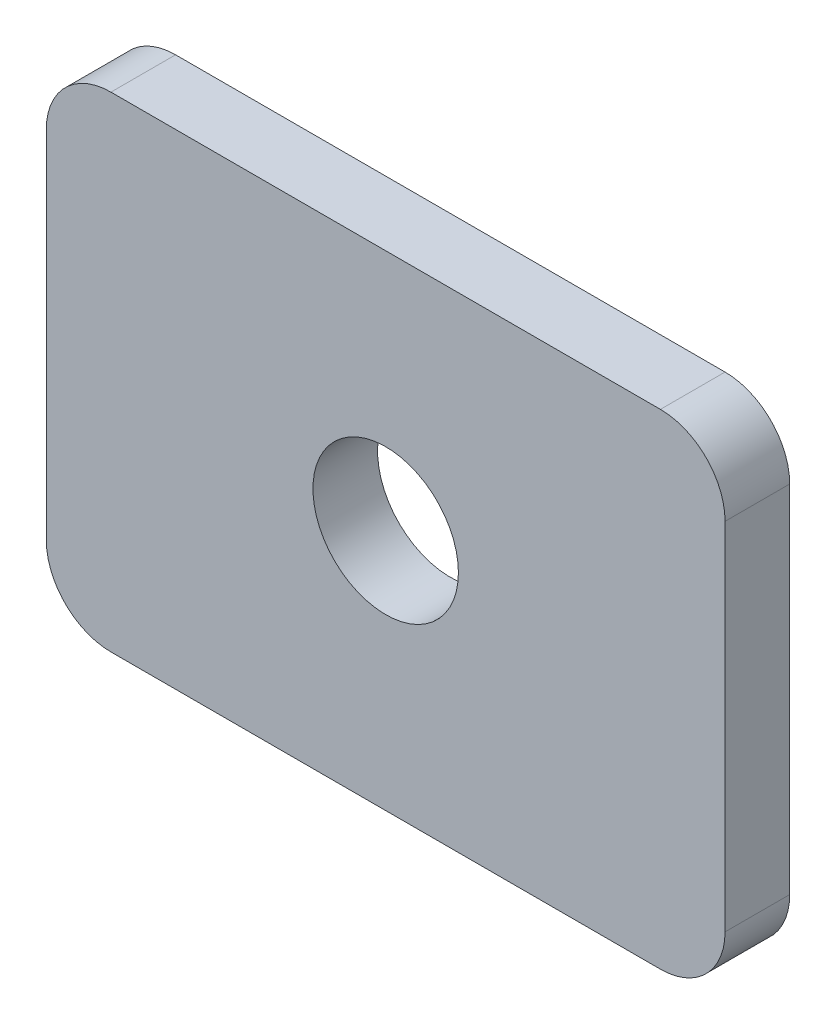
from build123d import *

# Parameters (mm, degrees)
SKETCH1_W           = 21
SKETCH1_H           = 15
BOSS_EXTRUDE1_DEPTH = 2
SKETCH2_R           = 2.25
CUT_EXTRUDE1_DEPTH  = 14.057564857
FILLET1_R           = 2


with BuildPart() as part:
    # Sketch1 → Boss-Extrude1 (new body)
    with BuildSketch(Plane.XY):
        Rectangle(SKETCH1_W, SKETCH1_H)
    extrude(amount=-BOSS_EXTRUDE1_DEPTH)

    # Sketch2 → Cut-Extrude1 (cut, through all)
    with BuildSketch(Plane.XY):
        Circle(SKETCH2_R)
    extrude(amount=-CUT_EXTRUDE1_DEPTH, mode=Mode.SUBTRACT)

    # Fillet1
    fillet1_edges = [part.edges().sort_by_distance(p)[0] for p in [
        (10.5, -7.5, -1),
        (-10.5, -7.5, -1),
        (-10.5, 7.5, -1),
        (10.5, 7.5, -1),
    ]]
    fillet(fillet1_edges, radius=FILLET1_R)


solid = part.part
